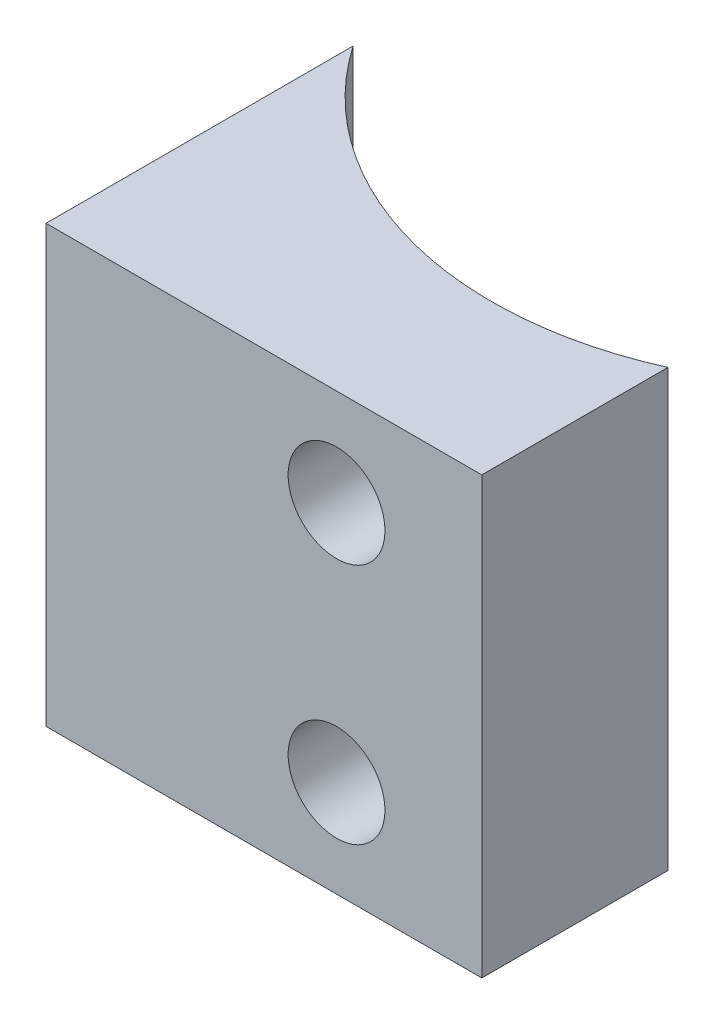
from build123d import *

# Parameters (mm, degrees)
BOSS_EXTRUDE1_DEPTH      = 15
BOSS_EXTRUDE1_DEPTH_BACK = 30
SKETCH2_R                = 5
CUT_EXTRUDE1_DEPTH       = 53.966825438


with BuildPart() as part:
    # Sketch1 → Boss-Extrude1 (new, two sides: drawn at the far end of the back side and taken through both)
    with BuildSketch(Plane(origin=(0, 0, 0), x_dir=(1, 0, 0), z_dir=(0, 1, 0)).offset(-BOSS_EXTRUDE1_DEPTH_BACK)):
        with BuildLine():
            ThreePointArc((15, -33.275366264), (-9.757930329, -35.171477019), (-30, -20.790622886))
            Line((-30, -20.790622886), (-30, -52.5))
            Line((-30, -52.5), (15, -52.5))
            Line((15, -52.5), (15, -33.275366264))
        make_face()
    extrude(amount=BOSS_EXTRUDE1_DEPTH + BOSS_EXTRUDE1_DEPTH_BACK)

    # Sketch2 → Cut-Extrude1 (cut, through all)
    with BuildSketch(Plane.XY.offset(52.5)):
        with Locations((0, -20)):
            Circle(SKETCH2_R)
        with Locations((0, 5)):
            Circle(SKETCH2_R)
    extrude(amount=-CUT_EXTRUDE1_DEPTH, mode=Mode.SUBTRACT)


solid = part.part
